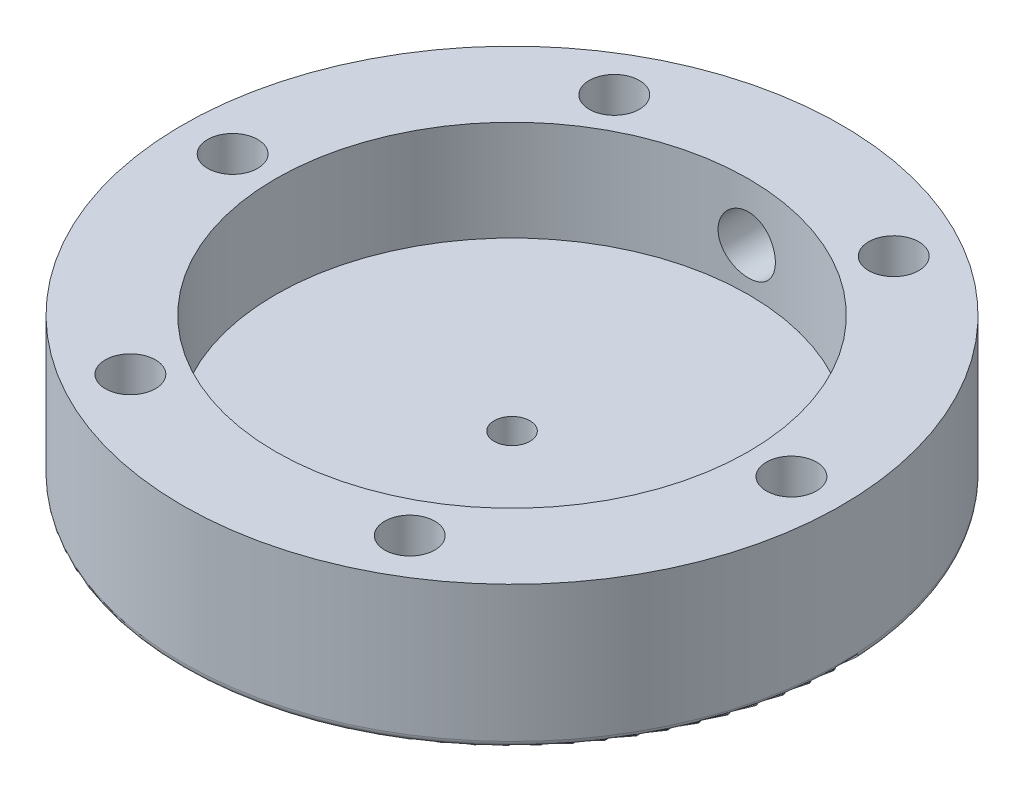
from build123d import *

# Parameters (mm, degrees)
SKETCH1_R           = 46
BOSS_EXTRUDE1_DEPTH = 20
SKETCH2_R           = 12
BOSS_EXTRUDE2_DEPTH = 10
SKETCH3_R           = 33
CUT_EXTRUDE1_DEPTH  = 14
SKETCH4_R           = 2.5
CUT_EXTRUDE2_DEPTH  = 72.637978754
SKETCH5_R           = 3.5
CUT_EXTRUDE3_DEPTH  = 69.058798109
FILLET1_R           = 1
SKETCH6_R           = 7
CUT_EXTRUDE4_DEPTH  = 10
CHAMFER1_SIZE       = 1
SKETCH8_R           = 4
CUT_EXTRUDE5_DEPTH  = 250


with BuildPart() as part:
    # Sketch1 → Boss-Extrude1 (new body)
    with BuildSketch(Plane(origin=(0, 0, 0), x_dir=(1, 0, 0), z_dir=(0, 1, 0))):
        with Locations(Location((0, 0, 0), (0, 0, 270))):
            Circle(SKETCH1_R)
    extrude(amount=BOSS_EXTRUDE1_DEPTH)

    # Sketch2 → Boss-Extrude2 (add)
    with BuildSketch(Plane.XZ):
        with Locations(Location((0, 0, 0), (0, 0, 270))):
            Circle(SKETCH2_R)
    extrude(amount=BOSS_EXTRUDE2_DEPTH)

    # Sketch3 → Cut-Extrude1 (cut)
    with BuildSketch(Plane(origin=(0, 20, 0), x_dir=(1, 0, 0), z_dir=(0, 1, 0))):
        with Locations(Location((0, 0, 0), (0, 0, 270))):
            Circle(SKETCH3_R)
    extrude(amount=-CUT_EXTRUDE1_DEPTH, mode=Mode.SUBTRACT)

    # Sketch4 → Cut-Extrude2 (cut, through all)
    with BuildSketch(Plane.XZ.offset(10)):
        with Locations(Location((0, 0, 0), (0, 0, 270))):
            Circle(SKETCH4_R)
    extrude(amount=-CUT_EXTRUDE2_DEPTH, mode=Mode.SUBTRACT)

    # Sketch5 → Cut-Extrude3 (cut, through all)
    with BuildSketch(Plane.XZ):
        with Locations(Location((-39, 0, 0), (0, 0, 270))):
            Circle(SKETCH5_R)
        with Locations(Location((-19.5, 33.774990748, 0), (0, 0, 270))):
            Circle(SKETCH5_R)
        with Locations(Location((19.5, 33.774990748, 0), (0, 0, 270))):
            Circle(SKETCH5_R)
        with Locations(Location((39, 0, 0), (0, 0, 270))):
            Circle(SKETCH5_R)
        with Locations(Location((19.5, -33.774990748, 0), (0, 0, 270))):
            Circle(SKETCH5_R)
        with Locations(Location((-19.5, -33.774990748, 0), (0, 0, 270))):
            Circle(SKETCH5_R)
    extrude(amount=-CUT_EXTRUDE3_DEPTH, mode=Mode.SUBTRACT)

    # Fillet1
    fillet1_edges = [part.edges().sort_by_distance(p)[0] for p in [
        (0, 0, -46),
    ]]
    fillet(fillet1_edges, radius=FILLET1_R)

    # Sketch6 → Cut-Extrude4 (cut)
    with BuildSketch(Plane.XZ.offset(10)):
        with Locations(Location((0, 0, 0), (0, 0, 270))):
            Circle(SKETCH6_R)
    extrude(amount=-CUT_EXTRUDE4_DEPTH, mode=Mode.SUBTRACT)

    # Chamfer1
    chamfer1_edges = [part.edges().sort_by_distance(p)[0] for p in [
        (0, -10, 7),
    ]]
    chamfer(chamfer1_edges, length=CHAMFER1_SIZE)

    # Sketch8 → Cut-Extrude5 (cut)
    with BuildSketch(Plane.XY):
        with Locations((0, 12)):
            Circle(SKETCH8_R)
    extrude(amount=-CUT_EXTRUDE5_DEPTH, mode=Mode.SUBTRACT)


solid = part.part
